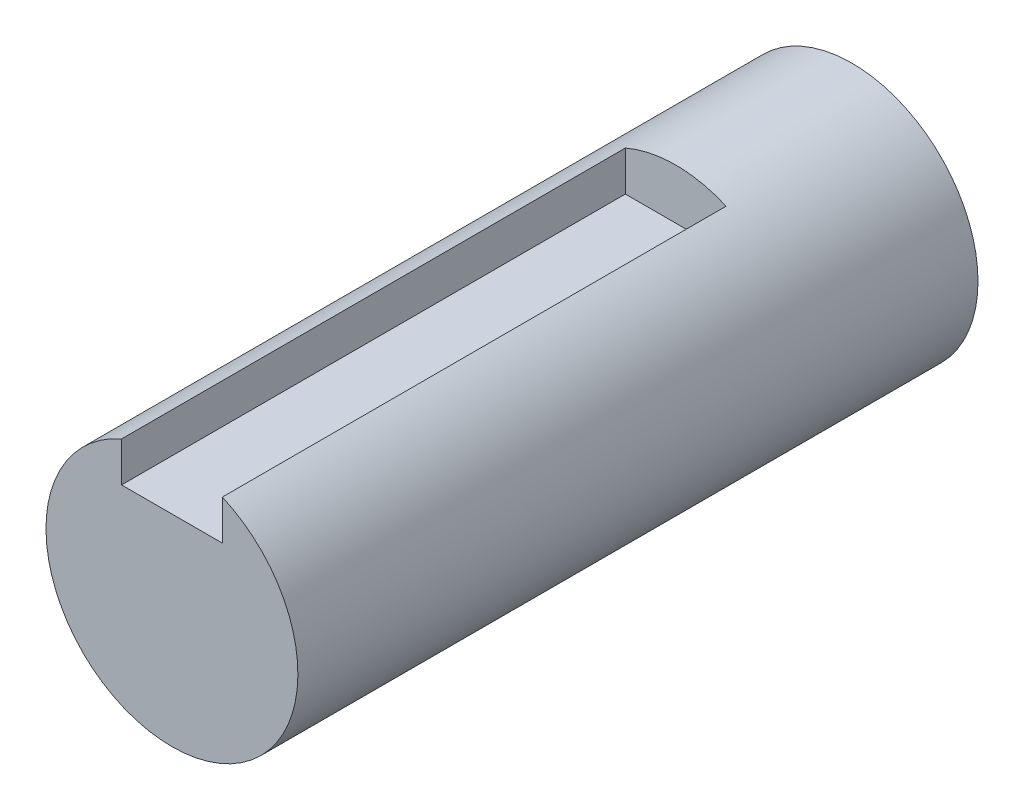
from build123d import *

# Parameters (mm, degrees)
SKETCH1_R           = 5
BOSS_EXTRUDE1_DEPTH = 27
SKETCH2_W           = 4
SKETCH2_H           = 4
CUT_EXTRUDE1_DEPTH  = 20


with BuildPart() as part:
    # Sketch1 → Boss-Extrude1 (new body)
    with BuildSketch(Plane.XY):
        Circle(SKETCH1_R)
    extrude(amount=BOSS_EXTRUDE1_DEPTH)

    # Sketch2 → Cut-Extrude1 (cut)
    with BuildSketch(Plane.XY.offset(27)):
        with Locations((0, 5)):
            Rectangle(SKETCH2_W, SKETCH2_H)
    extrude(amount=-CUT_EXTRUDE1_DEPTH, mode=Mode.SUBTRACT)


solid = part.part
